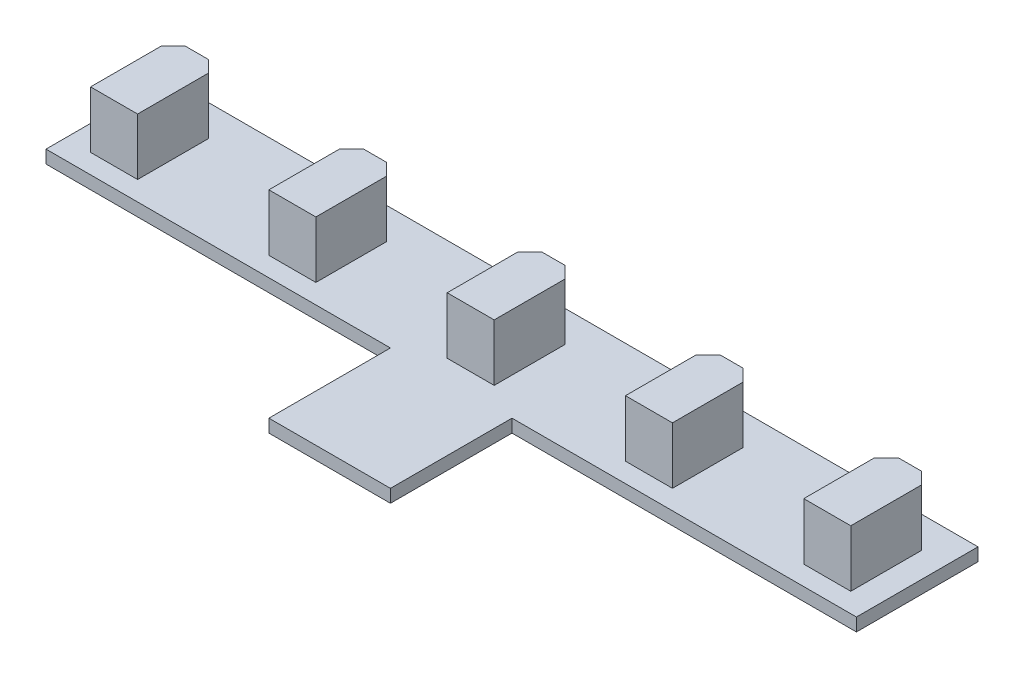
from build123d import *

# Parameters (mm, degrees)
BOSS_EXTRUDE1_DEPTH = 1.6
SKETCH1_3_W         = 10.56
SKETCH1_3_H         = 5
BOSS_EXTRUDE2_DEPTH = 2
BOSS_EXTRUDE3_DEPTH = 8.6


with BuildPart() as part:
    # Sketch1 → Boss-Extrude1 (new body)
    with BuildSketch(Plane(origin=(0, 0, 0), x_dir=(1, 0, 0), z_dir=(0, 1, 0))):
        Polygon((-7.5, 10.5), (-7.5, -4.5), (7.5, -4.5), (7.5, 10.5), (50, 10.5), (50, 25.5), (-50, 25.5), (-50, 10.5), align=None)
        Polygon((46.9, 21.630697763), (46.9, 12.9), (41.1, 12.9), (41.1, 21.630697763), (42.569302237, 23.1), (45.430697763, 23.1), align=None, mode=Mode.SUBTRACT)
        Polygon((-42.569302237, 23.1), (-41.1, 21.630697763), (-41.1, 12.9), (-46.9, 12.9), (-46.9, 21.630697763), (-45.430697763, 23.1), align=None, mode=Mode.SUBTRACT)
        Polygon((-20.569302237, 23.1), (-19.1, 21.630697763), (-19.1, 12.9), (-24.9, 12.9), (-24.9, 21.630697763), (-23.430697763, 23.1), align=None, mode=Mode.SUBTRACT)
        Polygon((2.9, 12.9), (-2.9, 12.9), (-2.9, 21.630697763), (-1.430697763, 23.1), (1.430697763, 23.1), (2.9, 21.630697763), align=None, mode=Mode.SUBTRACT)
        Polygon((23.430697763, 23.1), (24.9, 21.630697763), (24.9, 12.9), (19.1, 12.9), (19.1, 21.630697763), (20.569302237, 23.1), align=None, mode=Mode.SUBTRACT)
    extrude(amount=BOSS_EXTRUDE1_DEPTH)

    # Sketch1<3> → Boss-Extrude2 (add)
    with BuildSketch(Plane(origin=(0, 0, 0), x_dir=(1, 0, 0), z_dir=(0, 1, 0))):
        Rectangle(SKETCH1_3_W, SKETCH1_3_H)
    extrude(amount=-BOSS_EXTRUDE2_DEPTH)

    # Sketch1<4> → Boss-Extrude3 (add)
    with BuildSketch(Plane(origin=(0, 0, 0), x_dir=(1, 0, 0), z_dir=(0, 1, 0))):
        Polygon((-2.9, 21.630697763), (-2.9, 12.9), (2.9, 12.9), (2.9, 21.630697763), (1.430697763, 23.1), (-1.430697763, 23.1), align=None)
        Polygon((24.9, 12.9), (24.9, 21.630697763), (23.430697763, 23.1), (20.569302237, 23.1), (19.1, 21.630697763), (19.1, 12.9), align=None)
        Polygon((46.9, 12.9), (46.9, 21.630697763), (45.430697763, 23.1), (42.569302237, 23.1), (41.1, 21.630697763), (41.1, 12.9), align=None)
        Polygon((-19.1, 12.9), (-19.1, 21.630697763), (-20.569302237, 23.1), (-23.430697763, 23.1), (-24.9, 21.630697763), (-24.9, 12.9), align=None)
        Polygon((-41.1, 12.9), (-41.1, 21.630697763), (-42.569302237, 23.1), (-45.430697763, 23.1), (-46.9, 21.630697763), (-46.9, 12.9), align=None)
    extrude(amount=BOSS_EXTRUDE3_DEPTH)


solid = part.part
